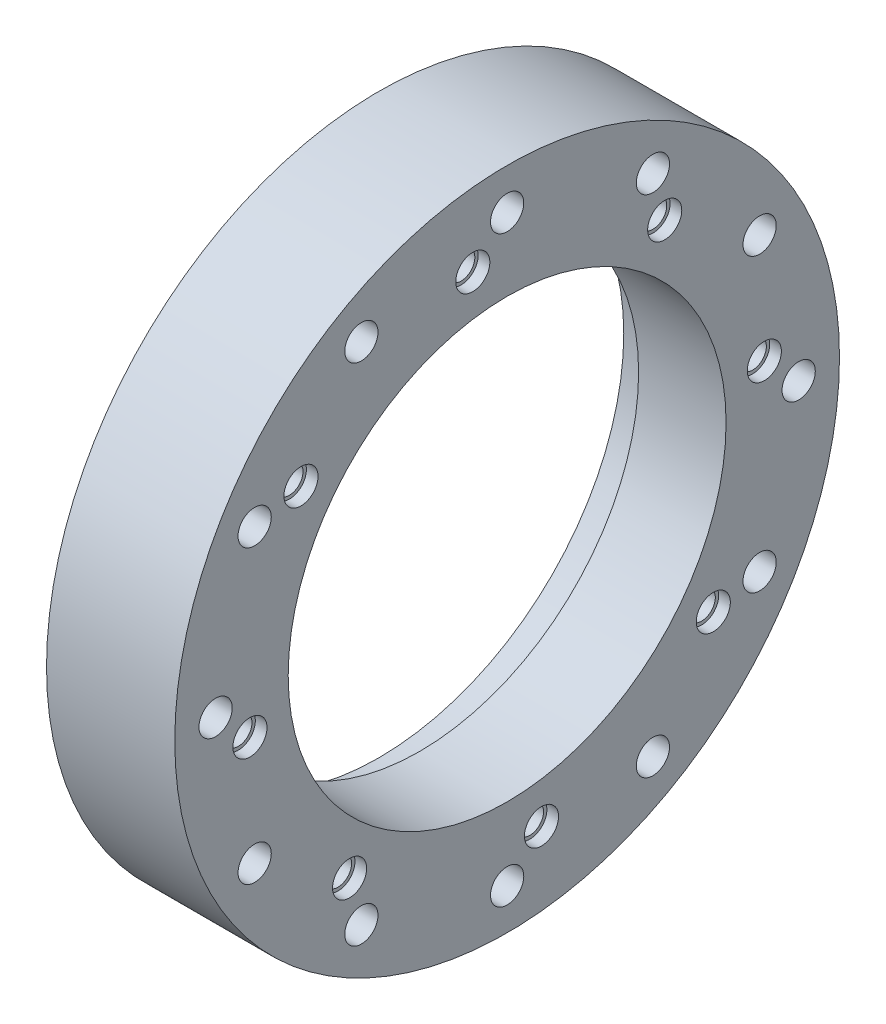
from build123d import *

# Parameters (mm, degrees)
SKETCH1_R           = 57.000000046
SKETCH1_R_2         = 45.72
BOSS_EXTRUDE1_DEPTH = 15
SKETCH3_R           = 49.001810824
SKETCH3_R_2         = 37.55
BOSS_EXTRUDE3_DEPTH = 15
CUT_EXTRUDE1_REACH  = 83.994
SKETCH4_R           = 2
SKETCH6_R           = 1.5
CUT_EXTRUDE2_DEPTH  = 82.993902276
CIRPATTERN2_COUNT   = 8
CIRPATTERN1_COUNT   = 12
SKETCH10_R          = 57.000000046
SKETCH10_R_2        = 42.000000046
SKETCH10_R_3        = 1.5
SKETCH10_R_4        = 2
BOSS_EXTRUDE4_DEPTH = 7
SKETCH12_R          = 2.35
CUT_EXTRUDE3_DEPTH  = 6.5
SKETCH13_R          = 2.925
CUT_EXTRUDE4_DEPTH  = 2
SKETCH14_R          = 2.85
CUT_EXTRUDE5_DEPTH  = 9


with BuildPart() as part:
    # Sketch1 → Boss-Extrude1 (new body)
    with BuildSketch(Plane(origin=(0, 0, 0), x_dir=(0, 0, -1), z_dir=(1, 0, 0))):
        Circle(SKETCH1_R)
        Circle(SKETCH1_R_2, mode=Mode.SUBTRACT)
    extrude(amount=BOSS_EXTRUDE1_DEPTH)

    # Sketch3 → Boss-Extrude3 (add)
    with BuildSketch(Plane.ZY):
        Circle(SKETCH3_R)
        Circle(SKETCH3_R_2, mode=Mode.SUBTRACT)
    extrude(amount=-BOSS_EXTRUDE3_DEPTH)

    # Sketch4 → Cut-Extrude1 (cut, up to next)
    with BuildSketch(Plane(origin=(15, 0, 0), x_dir=(0, 0, -1), z_dir=(1, 0, 0)), mode=Mode.PRIVATE) as cut_extrude1_sk1:
        with Locations((0, 50)):
            Circle(SKETCH4_R)
    cut_extrude1_tool1 = extrude(cut_extrude1_sk1.sketch, amount=-CUT_EXTRUDE1_REACH, mode=Mode.PRIVATE) & part.part
    cut_extrude1 = cut_extrude1_tool1.solids().sort_by_distance((15, 50, 0))[0]
    add(cut_extrude1, mode=Mode.SUBTRACT)

    # Sketch6 → Cut-Extrude2 (cut, through all)
    with BuildSketch(Plane(origin=(15, 0, 0), x_dir=(0, 0, -1), z_dir=(1, 0, 0))):
        with Locations((-5.891755706, 44.108244294)):
            Circle(SKETCH6_R)
    cut_extrude2 = extrude(amount=-CUT_EXTRUDE2_DEPTH, mode=Mode.SUBTRACT)

    # CirPattern2: Cut-Extrude2 ×8 about axis
    cirpattern2_axis = Axis((0, 0, 0), (1, 0, 0))
    for i in range(1, CIRPATTERN2_COUNT):
        add(cut_extrude2.rotate(cirpattern2_axis, i * 360 / CIRPATTERN2_COUNT), mode=Mode.SUBTRACT)

    # CirPattern1: Cut-Extrude1 ×12 about axis
    cirpattern1_axis = Axis((0, 0, 0), (1, 0, 0))
    for i in range(1, CIRPATTERN1_COUNT):
        add(cut_extrude1.rotate(cirpattern1_axis, i * 360 / CIRPATTERN1_COUNT), mode=Mode.SUBTRACT)

    # Sketch10 → Boss-Extrude4 (add)
    with BuildSketch(Plane.ZY):
        Circle(SKETCH10_R)
        Circle(SKETCH10_R_2, mode=Mode.SUBTRACT)
        with Locations(Location((-27.023138234, 35.355339059, 0), (0, 0, 225))):
            Circle(SKETCH10_R_3, mode=Mode.SUBTRACT)
        with Locations(Location((5.891755706, 44.108244294, 0), (0, 0, 180))):
            Circle(SKETCH10_R_3, mode=Mode.SUBTRACT)
        with Locations(Location((35.355339059, 27.023138234, 0), (0, 0, 135))):
            Circle(SKETCH10_R_3, mode=Mode.SUBTRACT)
        with Locations(Location((44.108244294, -5.891755706, 0), (0, 0, 90))):
            Circle(SKETCH10_R_3, mode=Mode.SUBTRACT)
        with Locations(Location((27.023138234, -35.355339059, 0), (0, 0, 45))):
            Circle(SKETCH10_R_3, mode=Mode.SUBTRACT)
        with Locations(Location((-44.108244294, 5.891755706, 0), (0, 0, 270))):
            Circle(SKETCH10_R_3, mode=Mode.SUBTRACT)
        with Locations(Location((-35.355339059, -27.023138234, 0), (0, 0, 315))):
            Circle(SKETCH10_R_3, mode=Mode.SUBTRACT)
        with Locations((-5.891755706, -44.108244294)):
            Circle(SKETCH10_R_3, mode=Mode.SUBTRACT)
        with Locations(Location((-25, 43.301270189, 0), (0, 0, 180))):
            Circle(SKETCH10_R_4, mode=Mode.SUBTRACT)
        with Locations(Location((0, 50, 0), (0, 0, 180))):
            Circle(SKETCH10_R_4, mode=Mode.SUBTRACT)
        with Locations(Location((25, 43.301270189, 0), (0, 0, 180))):
            Circle(SKETCH10_R_4, mode=Mode.SUBTRACT)
        with Locations(Location((43.301270189, 25, 0), (0, 0, 180))):
            Circle(SKETCH10_R_4, mode=Mode.SUBTRACT)
        with Locations(Location((50, 0, 0), (0, 0, 180))):
            Circle(SKETCH10_R_4, mode=Mode.SUBTRACT)
        with Locations(Location((43.301270189, -25, 0), (0, 0, 180))):
            Circle(SKETCH10_R_4, mode=Mode.SUBTRACT)
        with Locations(Location((25, -43.301270189, 0), (0, 0, 180))):
            Circle(SKETCH10_R_4, mode=Mode.SUBTRACT)
        with Locations(Location((0, -50, 0), (0, 0, 180))):
            Circle(SKETCH10_R_4, mode=Mode.SUBTRACT)
        with Locations(Location((-25, -43.301270189, 0), (0, 0, 180))):
            Circle(SKETCH10_R_4, mode=Mode.SUBTRACT)
        with Locations(Location((-43.301270189, -25, 0), (0, 0, 180))):
            Circle(SKETCH10_R_4, mode=Mode.SUBTRACT)
        with Locations(Location((-50, 0, 0), (0, 0, 180))):
            Circle(SKETCH10_R_4, mode=Mode.SUBTRACT)
        with Locations(Location((-43.301270189, 25, 0), (0, 0, 180))):
            Circle(SKETCH10_R_4, mode=Mode.SUBTRACT)
    extrude(amount=BOSS_EXTRUDE4_DEPTH)

    # Sketch12 → Cut-Extrude3 (cut)
    with BuildSketch(Plane(origin=(15, 0, 0), x_dir=(0, 0, -1), z_dir=(1, 0, 0))):
        with Locations((-35.355339059, 27.023138234)):
            Circle(SKETCH12_R)
        with Locations((-5.891755706, 44.108244294)):
            Circle(SKETCH12_R)
        with Locations((27.023138234, 35.355339059)):
            Circle(SKETCH12_R)
        with Locations((44.108244294, 5.891755706)):
            Circle(SKETCH12_R)
        with Locations((35.355339059, -27.023138234)):
            Circle(SKETCH12_R)
        with Locations((5.891755706, -44.108244294)):
            Circle(SKETCH12_R)
        with Locations((-27.023138234, -35.355339059)):
            Circle(SKETCH12_R)
        with Locations((-44.108244294, -5.891755706)):
            Circle(SKETCH12_R)
    extrude(amount=-CUT_EXTRUDE3_DEPTH, mode=Mode.SUBTRACT)

    # Sketch13 → Cut-Extrude4 (cut)
    with BuildSketch(Plane(origin=(15, 0, 0), x_dir=(0, 0, -1), z_dir=(1, 0, 0))):
        with Locations((-35.355339059, 27.023138234)):
            Circle(SKETCH13_R)
        with Locations((-5.891755706, 44.108244294)):
            Circle(SKETCH13_R)
        with Locations((27.023138234, 35.355339059)):
            Circle(SKETCH13_R)
        with Locations((44.108244294, 5.891755706)):
            Circle(SKETCH13_R)
        with Locations((35.355339059, -27.023138234)):
            Circle(SKETCH13_R)
        with Locations((5.891755706, -44.108244294)):
            Circle(SKETCH13_R)
        with Locations((-27.023138234, -35.355339059)):
            Circle(SKETCH13_R)
        with Locations((-44.108244294, -5.891755706)):
            Circle(SKETCH13_R)
    extrude(amount=-CUT_EXTRUDE4_DEPTH, mode=Mode.SUBTRACT)

    # Sketch14 → Cut-Extrude5 (cut)
    with BuildSketch(Plane(origin=(15, 0, 0), x_dir=(0, 0, -1), z_dir=(1, 0, 0))):
        with Locations((-43.301270189, 25)):
            Circle(SKETCH14_R)
        with Locations((-25, 43.301270189)):
            Circle(SKETCH14_R)
        with Locations((0, 50)):
            Circle(SKETCH14_R)
        with Locations((25, 43.301270189)):
            Circle(SKETCH14_R)
        with Locations((43.301270189, 25)):
            Circle(SKETCH14_R)
        with Locations((50, 0)):
            Circle(SKETCH14_R)
        with Locations((43.301270189, -25)):
            Circle(SKETCH14_R)
        with Locations((25, -43.301270189)):
            Circle(SKETCH14_R)
        with Locations((0, -50)):
            Circle(SKETCH14_R)
        with Locations((-25, -43.301270189)):
            Circle(SKETCH14_R)
        with Locations((-43.301270189, -25)):
            Circle(SKETCH14_R)
        with Locations((-50, 0)):
            Circle(SKETCH14_R)
    extrude(amount=-CUT_EXTRUDE5_DEPTH, mode=Mode.SUBTRACT)


solid = part.part
